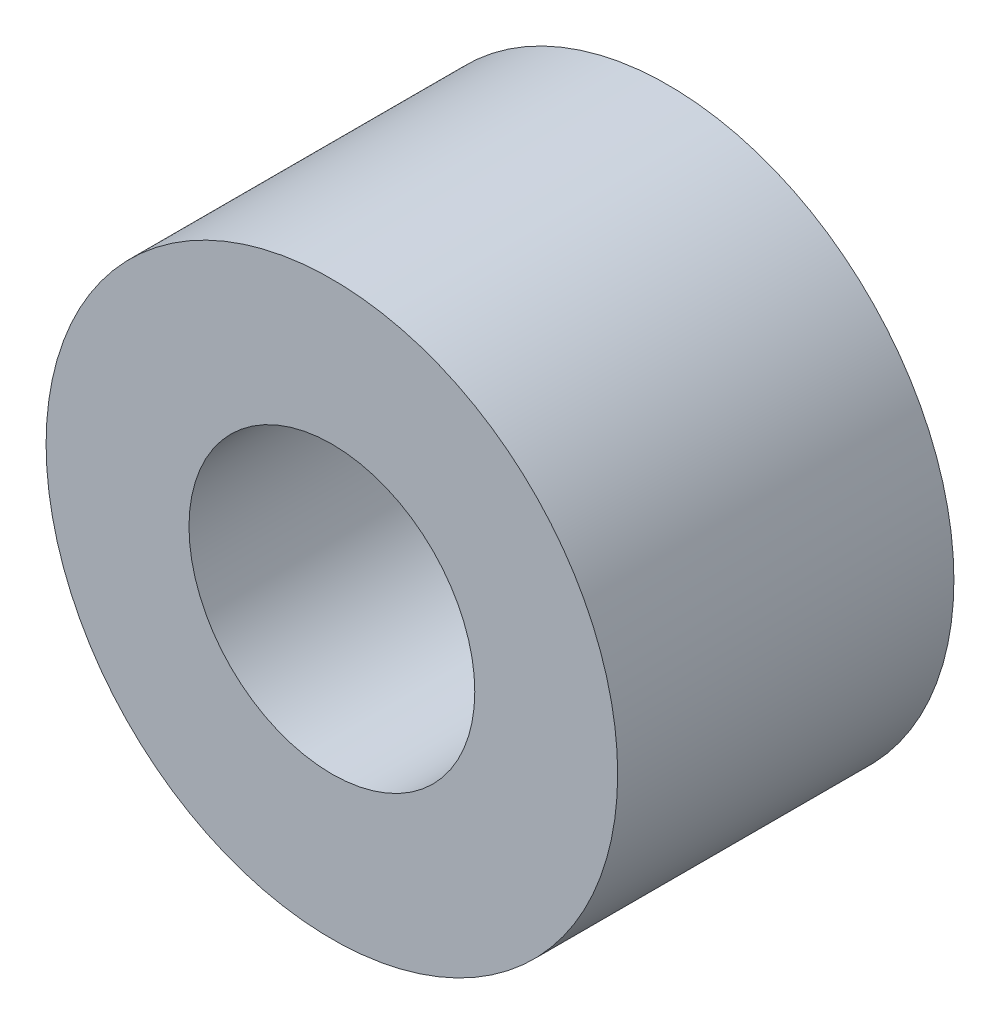
from build123d import *

# Parameters (mm, degrees)
ESQUISSE1_R        = 8.5
ESQUISSE1_R_2      = 4.25
BOSS_EXTRU_1_DEPTH = 10


with BuildPart() as part:
    # Esquisse1 → Boss.-Extru.1 (new body)
    with BuildSketch(Plane.XY):
        Circle(ESQUISSE1_R)
        Circle(ESQUISSE1_R_2, mode=Mode.SUBTRACT)
    extrude(amount=BOSS_EXTRU_1_DEPTH)


solid = part.part
